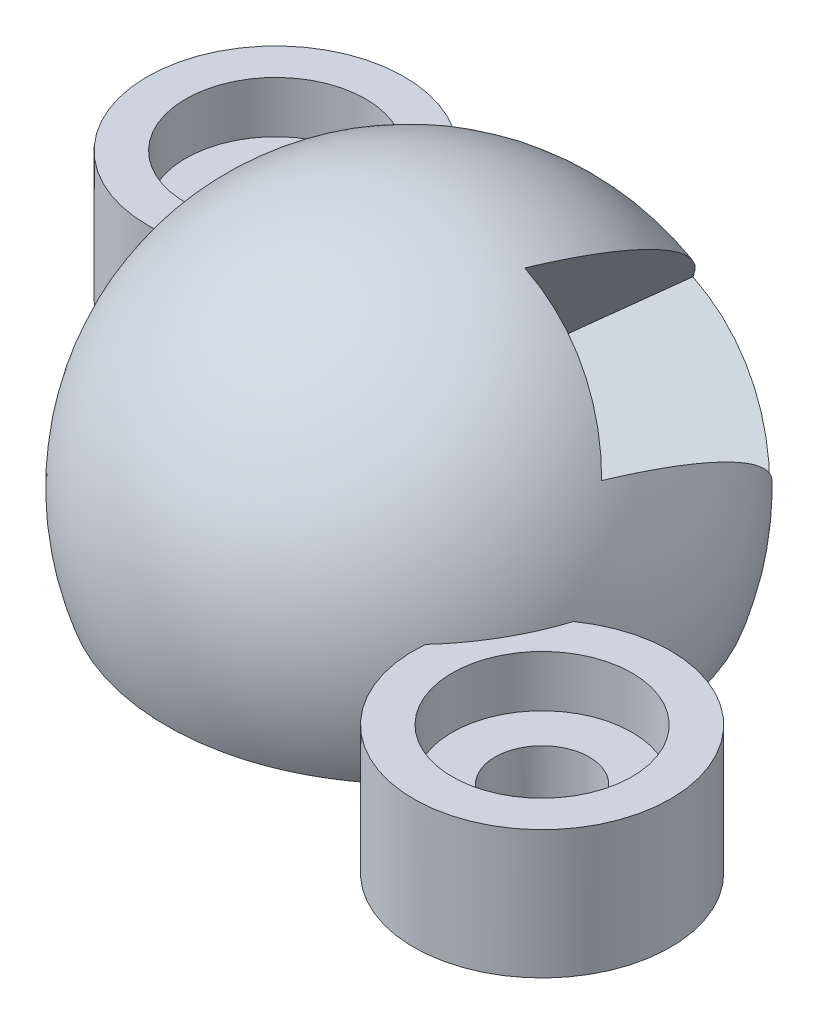
from build123d import *

# Parameters (mm, degrees)
DOME_TRIM_SKETCH_W           = 13.999999999999993
DOME_TRIM_SKETCH_H           = 5.000000000000014
DOME_TRIM_DEPTH              = 14
RETAINER_FEATURE_3_PROFILE_R = 3.0000000000000027
RETAINER_FEATURE_3_DEPTH     = 3
RETAINER_FEATURE_4_PROFILE_R = 3.0000000000000027
RETAINER_FEATURE_4_DEPTH     = 3
RETAINER_FEATURE_6_PROFILE_R = 1.1000000000000036
RETAINER_FEATURE_6_DEPTH     = 4.25
RETAINER_FEATURE_7_PROFILE_R = 2.1000000000000045
RETAINER_FEATURE_7_DEPTH     = 1.45
RETAINER_FEATURE_8_PROFILE_R = 1.1000000000000036
RETAINER_FEATURE_8_DEPTH     = 4.25
RETAINER_FEATURE_9_PROFILE_R = 2.1000000000000045
RETAINER_FEATURE_9_DEPTH     = 1.45
RETAINER_FEATURE_12_DEPTH    = 10


with BuildPart() as part:
    # Retainer Dome Sketch → Retainer Dome (revolve)
    with BuildSketch(Plane(origin=(0, -73, 0), x_dir=(-1, 0, 0), z_dir=(0, -1, 0))):
        with BuildLine():
            Line((76.48780366869515, -22.98076211353316), (66.09549882328189, -28.980762113533164))
            ThreePointArc((66.09549882328189, -28.980762113533164), (74.29165124598852, -31.176914536239792), (76.48780366869515, -22.98076211353316))
        make_face()
    revolve(axis=Axis((-62.63139720814413, -73, 30.98076211353316), (-0.8660254037844387, 0, -0.49999999999999994)))

    # Dome Trim Sketch → Dome Trim (cut)
    with BuildSketch(Plane(origin=(-36.156560608000376, 0, -20.874999999999996), x_dir=(-0.49999999999999944, 0, 0.866025403784439), z_dir=(-0.866025403784439, 0, -0.49999999999999944))):
        with Locations((58.145825622994224, -68.5)):
            Rectangle(DOME_TRIM_SKETCH_W, DOME_TRIM_SKETCH_H)
    extrude(amount=DOME_TRIM_DEPTH, mode=Mode.SUBTRACT)

    # Retainer Feature 3 profile → Retainer Feature 3 (add)
    with BuildSketch(Plane(origin=(0, -71.00000000000001, 0), x_dir=(-1, 0, 0), z_dir=(0, -1, 0))):
        with Locations((63.93043531382078, -30.23076211353316)):
            Circle(RETAINER_FEATURE_3_PROFILE_R)
    extrude(amount=RETAINER_FEATURE_3_DEPTH)

    # Retainer Feature 4 profile → Retainer Feature 4 (add)
    with BuildSketch(Plane(origin=(0, -71.00000000000001, 0), x_dir=(-1, 0, 0), z_dir=(0, -1, 0))):
        with Locations((78.65286717815624, -21.73076211353316)):
            Circle(RETAINER_FEATURE_4_PROFILE_R)
    extrude(amount=RETAINER_FEATURE_4_DEPTH)

    # Spherical Seat Sketch → Spherical Seat (revolve, cut)
    with BuildSketch(Plane(origin=(0, -73, 0), x_dir=(-1, 0, 0), z_dir=(0, -1, 0))):
        with BuildLine():
            Line((74.0196312679095, -24.405762113533164), (68.56367122406753, -27.55576211353316))
            ThreePointArc((68.56367122406753, -27.55576211353316), (72.86665124598852, -28.708742135454145), (74.0196312679095, -24.405762113533164))
        make_face()
    revolve(axis=Axis((-62.63139720814413, -73, 30.98076211353316), (-0.8660254037844387, 0, -0.49999999999999994)), mode=Mode.SUBTRACT)

    # Retainer Feature 6 profile → Retainer Feature 6 (cut)
    with BuildSketch(Plane(origin=(0, -70, 0), x_dir=(-1, 0, 0), z_dir=(0, -1, 0))):
        with Locations(Location((63.93043531382078, -30.23076211353316, 0), (0, 0, 270))):
            Circle(RETAINER_FEATURE_6_PROFILE_R)
    extrude(amount=RETAINER_FEATURE_6_DEPTH, mode=Mode.SUBTRACT)

    # Retainer Feature 7 profile → Retainer Feature 7 (cut)
    with BuildSketch(Plane(origin=(0, -72.8, 0), x_dir=(-1, 0, 0), z_dir=(0, -1, 0))):
        with Locations(Location((63.93043531382078, -30.23076211353316, 0), (0, 0, 90))):
            Circle(RETAINER_FEATURE_7_PROFILE_R)
    extrude(amount=RETAINER_FEATURE_7_DEPTH, mode=Mode.SUBTRACT)

    # Retainer Feature 8 profile → Retainer Feature 8 (cut)
    with BuildSketch(Plane(origin=(0, -70, 0), x_dir=(-1, 0, 0), z_dir=(0, -1, 0))):
        with Locations(Location((78.65286717815624, -21.73076211353316, 0), (0, 0, 270))):
            Circle(RETAINER_FEATURE_8_PROFILE_R)
    extrude(amount=RETAINER_FEATURE_8_DEPTH, mode=Mode.SUBTRACT)

    # Retainer Feature 9 profile → Retainer Feature 9 (cut)
    with BuildSketch(Plane(origin=(0, -72.8, 0), x_dir=(-1, 0, 0), z_dir=(0, -1, 0))):
        with Locations(Location((78.65286717815624, -21.73076211353316, 0), (0, 0, 90))):
            Circle(RETAINER_FEATURE_9_PROFILE_R)
    extrude(amount=RETAINER_FEATURE_9_DEPTH, mode=Mode.SUBTRACT)

    # Middle Right Fixed Compression Ball Reta → Retainer Feature 12 (cut)
    with BuildSketch(Plane(origin=(-14.254693004611807, 11.570307263062045, 11.176575862570404), x_dir=(-0.403732922701292, 0.3277035826977628, -0.854172165909264), z_dir=(0.6631997284167646, -0.5383086561091629, -0.5199902989343905))):
        Polygon((-14.819319931758496, -98.86212155097724), (-20.944840012243684, -100.71630701731351), (-19.843917391606514, -104.3533345651016), (-13.718397311121315, -102.49914909876533), align=None)
    extrude(amount=RETAINER_FEATURE_12_DEPTH, mode=Mode.SUBTRACT)


with BuildPart() as body_2:
    # Mirror1: mirrored copy
    add(part.part.mirror(Plane(origin=(0, 0, 0), x_dir=(0, 0, 1), z_dir=(0, -1, 0))))


solid = body_2.part
